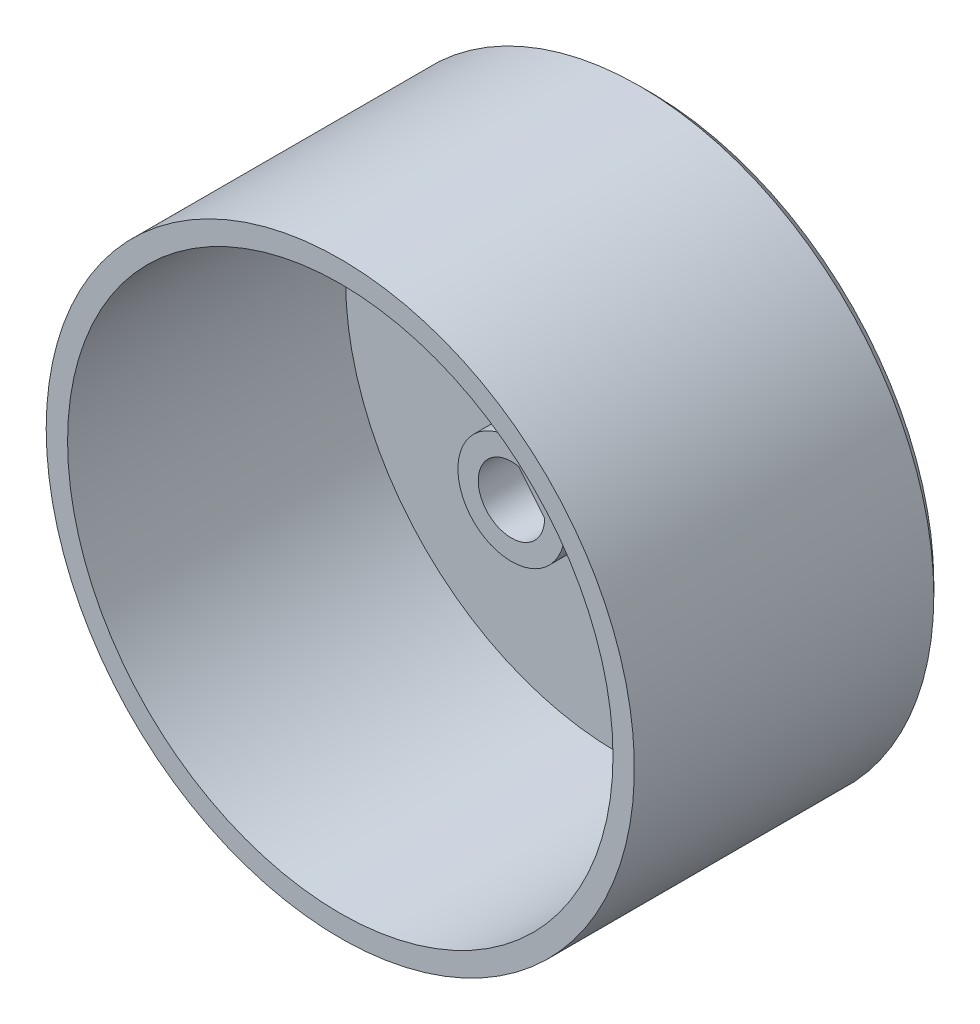
from build123d import *

# Parameters (mm, degrees)
SKETCH1_R           = 27.5
BOSS_EXTRUDE1_DEPTH = 29
SKETCH2_R           = 25.5
SKETCH2_R_2         = 5
CUT_EXTRUDE1_DEPTH  = 26
CUT_EXTRUDE2_DEPTH  = 26
SKETCH4_R           = 5
CUT_EXTRUDE3_DEPTH  = 16
CHAMFER1_SIZE       = 1


with BuildPart() as part:
    # Sketch1 → Boss-Extrude1 (new body)
    with BuildSketch(Plane.XY):
        with Locations(Location((0, 0, 0), (0, 0, 180))):
            Circle(SKETCH1_R)
    extrude(amount=BOSS_EXTRUDE1_DEPTH)

    # Sketch2 → Cut-Extrude1 (cut)
    with BuildSketch(Plane.XY.offset(29)):
        Circle(SKETCH2_R)
        Circle(SKETCH2_R_2, mode=Mode.SUBTRACT)
    extrude(amount=-CUT_EXTRUDE1_DEPTH, mode=Mode.SUBTRACT)

    # Sketch3 → Cut-Extrude2 (cut)
    with BuildSketch(Plane.XY.offset(29)):
        with BuildLine():
            Line((0.71010636, 3.017573356), (3.099332288, 0.064337932))
            ThreePointArc((3.099332288, 0.064337932), (-2.410053022, -1.949780611), (0.71010636, 3.017573356))
        make_face()
    extrude(amount=-CUT_EXTRUDE2_DEPTH, mode=Mode.SUBTRACT)

    # Sketch4 → Cut-Extrude3 (cut)
    with BuildSketch(Plane.XY.offset(29)):
        Circle(SKETCH4_R)
    extrude(amount=-CUT_EXTRUDE3_DEPTH, mode=Mode.SUBTRACT)

    # Chamfer1
    chamfer1_edges = [part.edges().sort_by_distance(p)[0] for p in [
        (27.5, 0, 0),
    ]]
    chamfer(chamfer1_edges, length=CHAMFER1_SIZE)


solid = part.part
